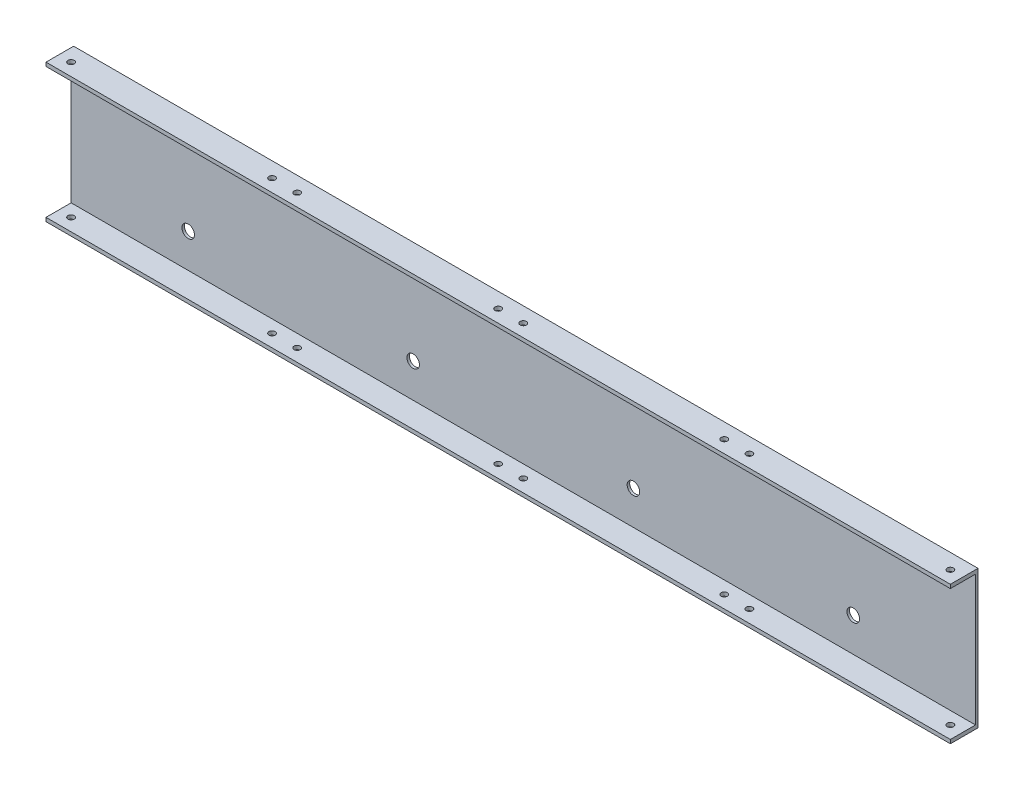
from build123d import *

# Parameters (mm, degrees)
SKETCH_1_W          = 720
SKETCH_1_H          = 110
SKETCH_1_R          = 5
EXTRUDE_1_DEPTH     = 2
SKETCH_2_W          = 720
SKETCH_2_H          = 3
EXTRUDE_2_DEPTH     = 20
SKETCH_3_R          = 2.5
CUT_EXTRUDE_3_DEPTH = 114


with BuildPart() as part:
    # 草图1 → 凸台-拉伸1 (new body)
    with BuildSketch(Plane.XY):
        with Locations((266.780748393, 19.519407272)):
            Rectangle(SKETCH_1_W, SKETCH_1_H)
        with Locations((0, -5.480592728)):
            Circle(SKETCH_1_R, mode=Mode.SUBTRACT)
        with Locations((179.094970205, -5.480592728)):
            Circle(SKETCH_1_R, mode=Mode.SUBTRACT)
        with Locations((354.466526581, -5.480592728)):
            Circle(SKETCH_1_R, mode=Mode.SUBTRACT)
        with Locations((529.466526581, -5.480592728)):
            Circle(SKETCH_1_R, mode=Mode.SUBTRACT)
    extrude(amount=EXTRUDE_1_DEPTH)

    # 草图2 → 凸台-拉伸2 (add)
    with BuildSketch(Plane.XY.offset(2)):
        with Locations((266.780748393, 73.019407272)):
            Rectangle(SKETCH_2_W, SKETCH_2_H)
        with Locations((266.780748393, -33.980592728)):
            Rectangle(SKETCH_2_W, SKETCH_2_H)
    extrude(amount=EXTRUDE_2_DEPTH)

    # 草图3 → 切除-拉伸3 (cut)
    with BuildSketch(Plane(origin=(0, 74.519407272, 0), x_dir=(1, 0, 0), z_dir=(0, 1, 0))):
        with Locations(Location((456.780748393, -12, 0), (0, 0, 270))):
            Circle(SKETCH_3_R)
        with Locations(Location((616.780748393, -12, 0), (0, 0, 270))):
            Circle(SKETCH_3_R)
        with Locations(Location((436.780748393, -12, 0), (0, 0, 270))):
            Circle(SKETCH_3_R)
        with Locations(Location((276.780748393, -12, 0), (0, 0, 270))):
            Circle(SKETCH_3_R)
        with Locations(Location((256.780748393, -12, 0), (0, 0, 270))):
            Circle(SKETCH_3_R)
        with Locations(Location((96.780748393, -12, 0), (0, 0, 270))):
            Circle(SKETCH_3_R)
        with Locations(Location((76.780748393, -12, 0), (0, 0, 270))):
            Circle(SKETCH_3_R)
        with Locations(Location((-83.219251607, -12, 0), (0, 0, 270))):
            Circle(SKETCH_3_R)
    extrude(amount=-CUT_EXTRUDE_3_DEPTH, mode=Mode.SUBTRACT)


solid = part.part
